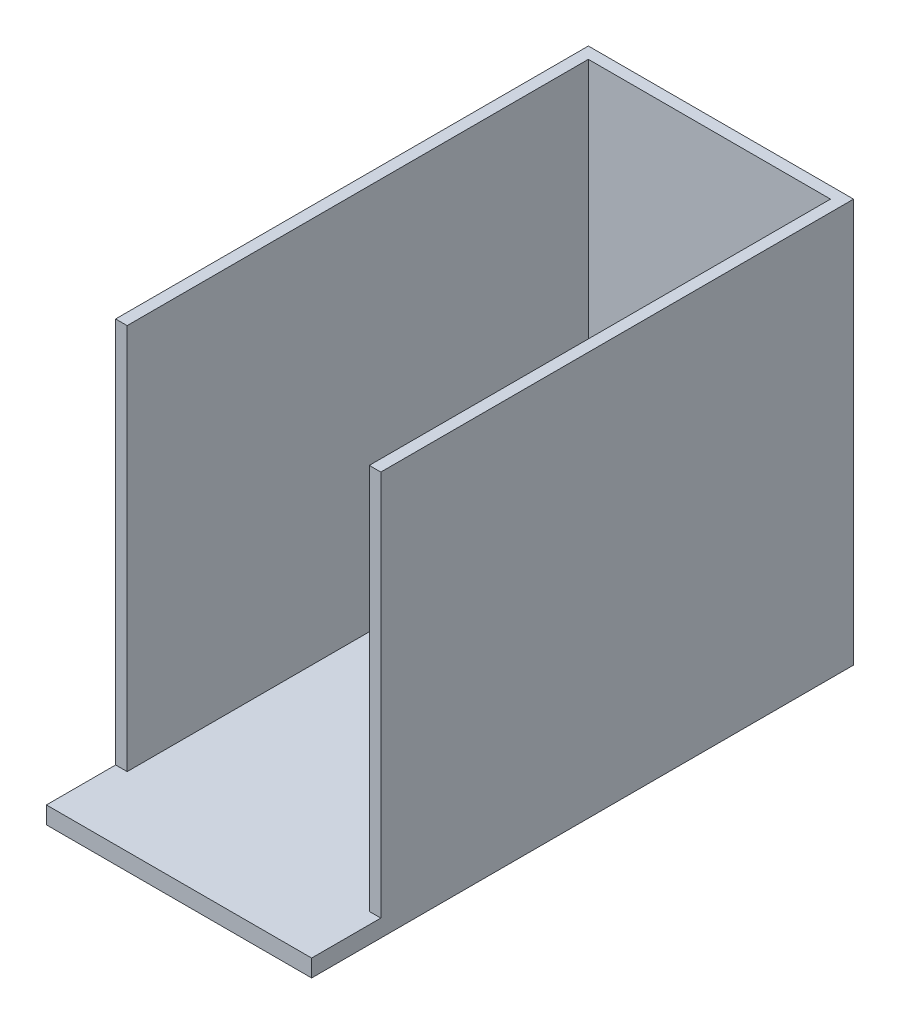
from build123d import *

# Parameters (mm, degrees)
SKETCH1_W           = 292.1
SKETCH1_H           = 596.9
BOSS_EXTRUDE1_DEPTH = 19.05
BOSS_EXTRUDE2_DEPTH = 425.45


with BuildPart() as part:
    # Sketch1 → Boss-Extrude1 (new body)
    with BuildSketch(Plane(origin=(0, 0, 0), x_dir=(1, 0, 0), z_dir=(0, 1, 0))):
        Rectangle(SKETCH1_W, SKETCH1_H)
    extrude(amount=BOSS_EXTRUDE1_DEPTH)

    # Sketch2 → Boss-Extrude2 (add)
    with BuildSketch(Plane(origin=(0, 19.05, 0), x_dir=(1, 0, 0), z_dir=(0, 1, 0))):
        Polygon((-146.05, -222.25), (-146.05, 298.45), (146.05, 298.45), (146.05, -222.25), (133.35, -222.25), (133.35, 285.75), (-133.35, 285.75), (-133.35, -222.25), align=None)
    extrude(amount=BOSS_EXTRUDE2_DEPTH)


solid = part.part
